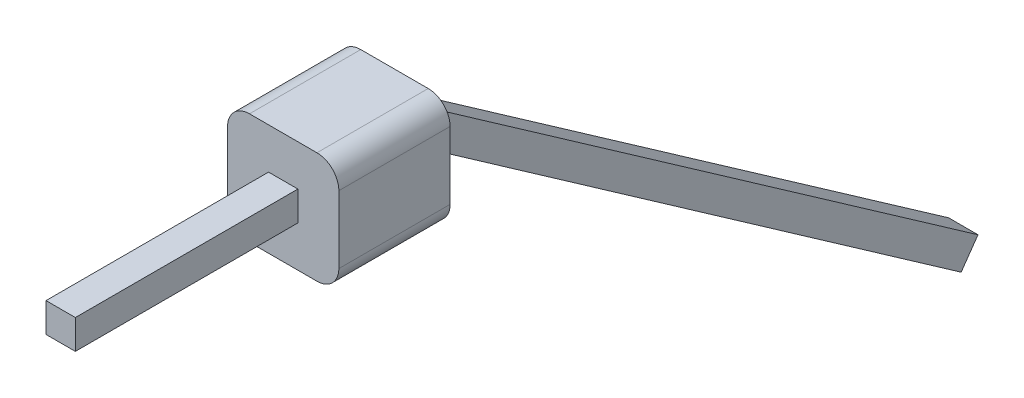
from build123d import *

# Parameters (mm, degrees)
SKETCH_1_W      = 2.54
SKETCH_1_H      = 2.54
EXTRUDE_1_DEPTH = 2.54
SKETCH_2_W      = 0.67
SKETCH_2_H      = 0.67
FILLET_1_R      = 0.5


with BuildPart() as part:
    # 草图1 → 拉伸1 (new body)
    with BuildSketch(Plane.XY):
        with Locations((0, -1.289090726)):
            Rectangle(SKETCH_1_W, SKETCH_1_H)
    extrude(amount=EXTRUDE_1_DEPTH)

    # 扫描1: sweep along a path in 草图3
    with BuildLine(Plane(origin=(0, 0, 0), x_dir=(0, 0, -1), z_dir=(1, 0, 0))) as sweep_1_path:
        Line((-7.62, -1.299090726), (0.5, -1.299090726))
        Line((0.5, -1.299090726), (12.787280664, -9.902737271))
    # 草图2 → 扫描1 (sweep)
    with BuildSketch(Plane(origin=(0, 0, 7.62), x_dir=(-1, 0, 0), z_dir=(0, 0, -1))):
        with Locations((0, -1.289090726)):
            Rectangle(SKETCH_2_W, SKETCH_2_H)
    sweep(path=sweep_1_path.line, transition=Transition.RIGHT)

    # 圆角1
    fillet_1_edges = [part.edges().sort_by_distance(p)[0] for p in [
        (-1.27, -0.019090726, 1.27),
        (1.27, -0.019090726, 1.27),
        (1.27, -2.559090726, 1.27),
        (-1.27, -2.559090726, 1.27),
    ]]
    fillet(fillet_1_edges, radius=FILLET_1_R)


solid = part.part
